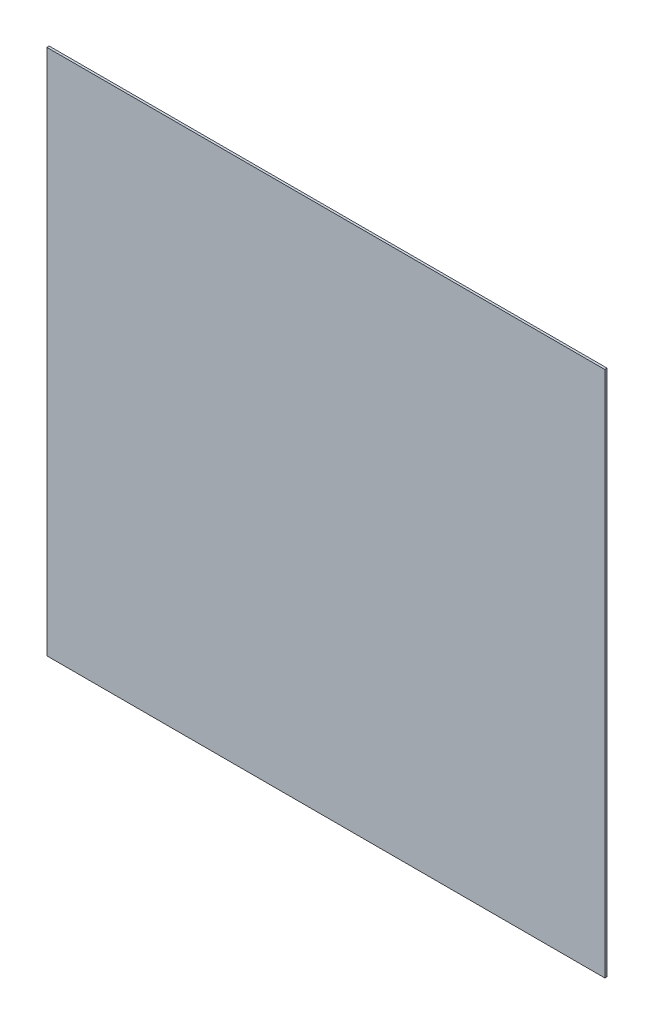
from build123d import *

# Parameters (mm, degrees)
SKETCH1_W           = 180
SKETCH1_H           = 170
BOSS_EXTRUDE1_DEPTH = 0.75


with BuildPart() as part:
    # Sketch1 → Boss-Extrude1 (new body)
    with BuildSketch(Plane.XY):
        with Locations((90, 85)):
            Rectangle(SKETCH1_W, SKETCH1_H)
    extrude(amount=BOSS_EXTRUDE1_DEPTH)


solid = part.part
